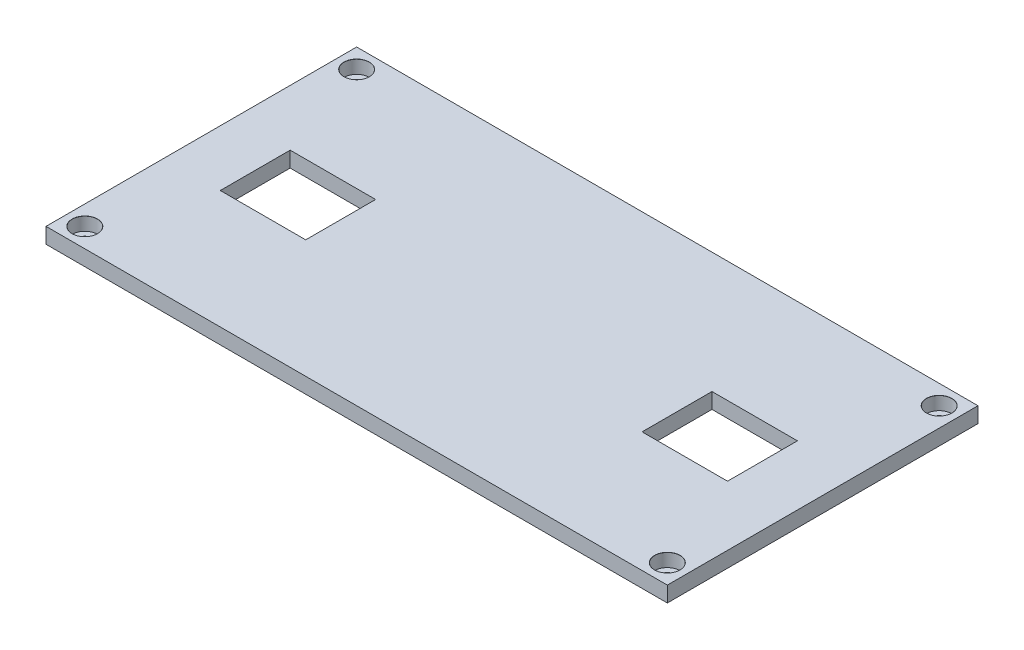
from build123d import *

# Parameters (mm, degrees)
SKETCH2_W                                    = 160
SKETCH2_H                                    = 80
BOSS_EXTRUDE1_DEPTH                          = 4
SKETCH3_W                                    = 22
SKETCH3_H                                    = 18
CUT_EXTRUDE1_DEPTH                           = 11
CBORE_FOR_M3_HEX_SOCKET_HEAD_CAP_SCR_2_COUNT = 2
CBORE_FOR_M3_HEX_SOCKET_HEAD_CAP_SCR_2_PITCH = 150
CBORE_FOR_M3_HEX_SOCKET_HEAD_CAP_SCR_3_COUNT = 2
CBORE_FOR_M3_HEX_SOCKET_HEAD_CAP_SCR_3_PITCH = 165.529453572
CBORE_FOR_M3_HEX_SOCKET_HEAD_CAP_SCR_4_COUNT = 2
CBORE_FOR_M3_HEX_SOCKET_HEAD_CAP_SCR_4_PITCH = 70


with BuildPart() as part:
    # Sketch2 → Boss-Extrude1 (new body)
    with BuildSketch(Plane(origin=(0, 0, 0), x_dir=(1, 0, 0), z_dir=(0, 1, 0))):
        Rectangle(SKETCH2_W, SKETCH2_H)
    extrude(amount=BOSS_EXTRUDE1_DEPTH)

    # Sketch3 → Cut-Extrude1 (cut)
    with BuildSketch(Plane(origin=(0, 4, 0), x_dir=(1, 0, 0), z_dir=(0, 1, 0))):
        with Locations((-54.553971888, -0.568270541)):
            Rectangle(SKETCH3_W, SKETCH3_H)
        with Locations((53.579793819, -0.081181506)):
            Rectangle(SKETCH3_W, SKETCH3_H)
    extrude(amount=-CUT_EXTRUDE1_DEPTH, mode=Mode.SUBTRACT)

    # Sketch7 → CBORE for M3 Hex Socket Head Cap Screw1 (revolve, cut)
    with BuildSketch(Plane(origin=(-75, 4, -35), x_dir=(0, 0, 1), z_dir=(1, 0, 0))):
        Polygon((0, 0), (0, 4), (1.7, 4), (1.7, 3.4), (3.25, 3.4), (3.25, 0.025), (3.275, 0), align=None)
    cbore_for_m3_hex_socket_head_cap_screw1 = revolve(axis=Axis((-75, 10.35, -35), (0, -1, 0)), mode=Mode.SUBTRACT)

    # CBORE for M3 Hex Socket Head Cap Scr 2: CBORE for M3 Hex Socket Head Cap Screw1 ×2
    with Locations(*[(i * CBORE_FOR_M3_HEX_SOCKET_HEAD_CAP_SCR_2_PITCH, 0, 0) for i in range(1, CBORE_FOR_M3_HEX_SOCKET_HEAD_CAP_SCR_2_COUNT)]):
        add(cbore_for_m3_hex_socket_head_cap_screw1, mode=Mode.SUBTRACT)

    # CBORE for M3 Hex Socket Head Cap Scr 3: CBORE for M3 Hex Socket Head Cap Screw1 ×2
    with Locations(*[Vector(0.9061831399952655, 0, 0.4228854653311239) * (i * CBORE_FOR_M3_HEX_SOCKET_HEAD_CAP_SCR_3_PITCH) for i in range(1, CBORE_FOR_M3_HEX_SOCKET_HEAD_CAP_SCR_3_COUNT)]):
        add(cbore_for_m3_hex_socket_head_cap_screw1, mode=Mode.SUBTRACT)

    # CBORE for M3 Hex Socket Head Cap Scr 4: CBORE for M3 Hex Socket Head Cap Screw1 ×2
    with Locations(*[(0, 0, i * CBORE_FOR_M3_HEX_SOCKET_HEAD_CAP_SCR_4_PITCH) for i in range(1, CBORE_FOR_M3_HEX_SOCKET_HEAD_CAP_SCR_4_COUNT)]):
        add(cbore_for_m3_hex_socket_head_cap_screw1, mode=Mode.SUBTRACT)


solid = part.part
